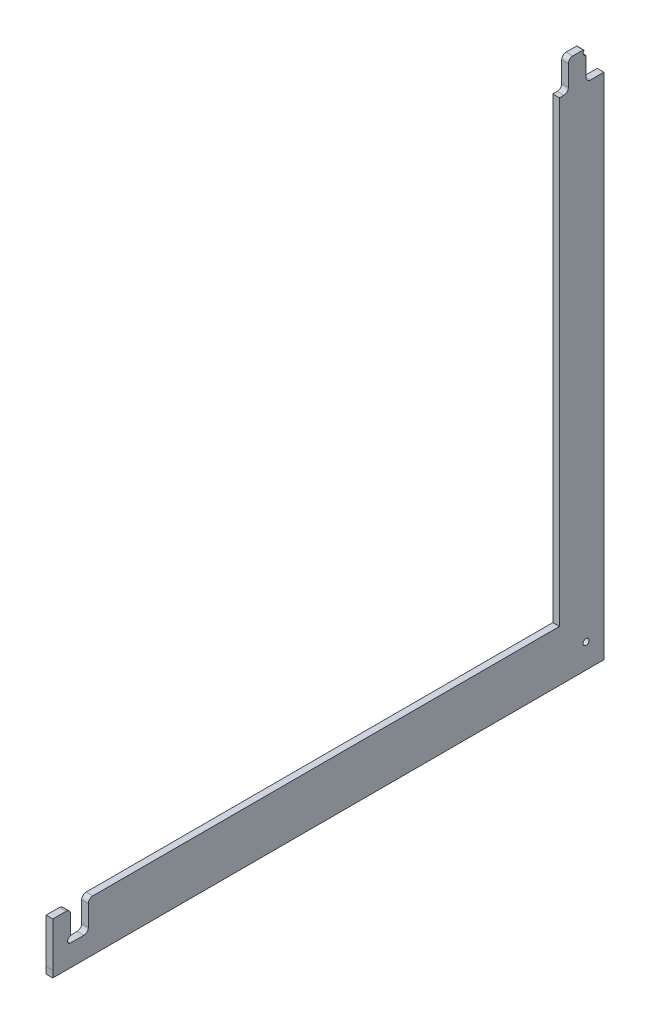
from build123d import *

# Parameters (mm, degrees)
SKETCH2_R           = 2
BOSS_EXTRUDE1_DEPTH = 4.5
CUT_EXTRUDE1_DEPTH  = 517.996374688
FILLET2_R           = 0.5
FILLET4_R           = 0.5
FILLET5_R           = 0.5
FILLET6_R           = 3
FILLET7_R           = 3


with BuildPart() as part:
    # Sketch2 → Boss-Extrude1 (new body)
    # profile 1 of 2: a face of its own
    with BuildSketch(Plane(origin=(0, 0, 0), x_dir=(0, 0, -1), z_dir=(1, 0, 0))):
        Polygon((-12, 339), (0, 339), (0, 0), (-372, 0), (-372, 30), (-360, 30), (-360, 10), (-348, 10), (-348, 30), (-30, 30), (-30, 339), (-24, 339), (-24, 359), (-12, 359), align=None)
        with Locations((-12, 12)):
            Circle(SKETCH2_R, mode=Mode.SUBTRACT)
    # profile 2 of 2: a face of its own
    with BuildSketch(Plane(origin=(0, 0, 0), x_dir=(0, 0, -1), z_dir=(1, 0, 0))):
        Polygon((-372.000001936, -4.49995894), (0, -4.500002581), (0, 0), (-372, 0), align=None)
    extrude(amount=BOSS_EXTRUDE1_DEPTH)

    # Sketch3 → Cut-Extrude1 (cut, through all)
    with BuildSketch(Plane(origin=(0, 0, 0), x_dir=(0, 0, -1), z_dir=(1, 0, 0))):
        with BuildLine():
            Line((-360, 14), (-360, 10))
            ThreePointArc((-360, 10), (-358.585786438, 10.585786438), (-358, 12))
            ThreePointArc((-358, 12), (-358.585786438, 13.414213562), (-360, 14))
        make_face()
        with BuildLine():
            ThreePointArc((-360, 14), (-362, 12), (-360, 10))
            Line((-360, 10), (-360, 14))
        make_face()
        with BuildLine():
            ThreePointArc((-12, 355), (-10.585786438, 355.585786438), (-10, 357))
            ThreePointArc((-10, 357), (-10.585786438, 358.414213562), (-12, 359))
            Line((-12, 359), (-12, 355))
        make_face()
        with BuildLine():
            Line((-12, 355), (-12, 359))
            ThreePointArc((-12, 359), (-14, 357), (-12, 355))
        make_face()
    extrude(amount=CUT_EXTRUDE1_DEPTH, mode=Mode.SUBTRACT)

    # Fillet2
    fillet2_edges = [part.edges().sort_by_distance(p)[0] for p in [
        (2.25, 355, 12),
    ]]
    fillet(fillet2_edges, radius=FILLET2_R)

    # Fillet4
    fillet4_edges = [part.edges().sort_by_distance(p)[0] for p in [
        (2.25, 359, 12),
    ]]
    fillet(fillet4_edges, radius=FILLET4_R)

    # Fillet5
    fillet5_edges = [part.edges().sort_by_distance(p)[0] for p in [
        (2.25, 14, 360),
    ]]
    fillet(fillet5_edges, radius=FILLET5_R)

    # Fillet6
    fillet6_edges = [part.edges().sort_by_distance(p)[0] for p in [
        (2.25, 30, 360),
        (2.25, 30, 348),
        (2.25, 339, 24),
        (2.25, 339, 12),
    ]]
    fillet(fillet6_edges, radius=FILLET6_R)

    # Fillet7
    fillet7_edges = [part.edges().sort_by_distance(p)[0] for p in [
        (2.25, 10, 348),
        (2.25, 359, 24),
    ]]
    fillet(fillet7_edges, radius=FILLET7_R)


solid = part.part
